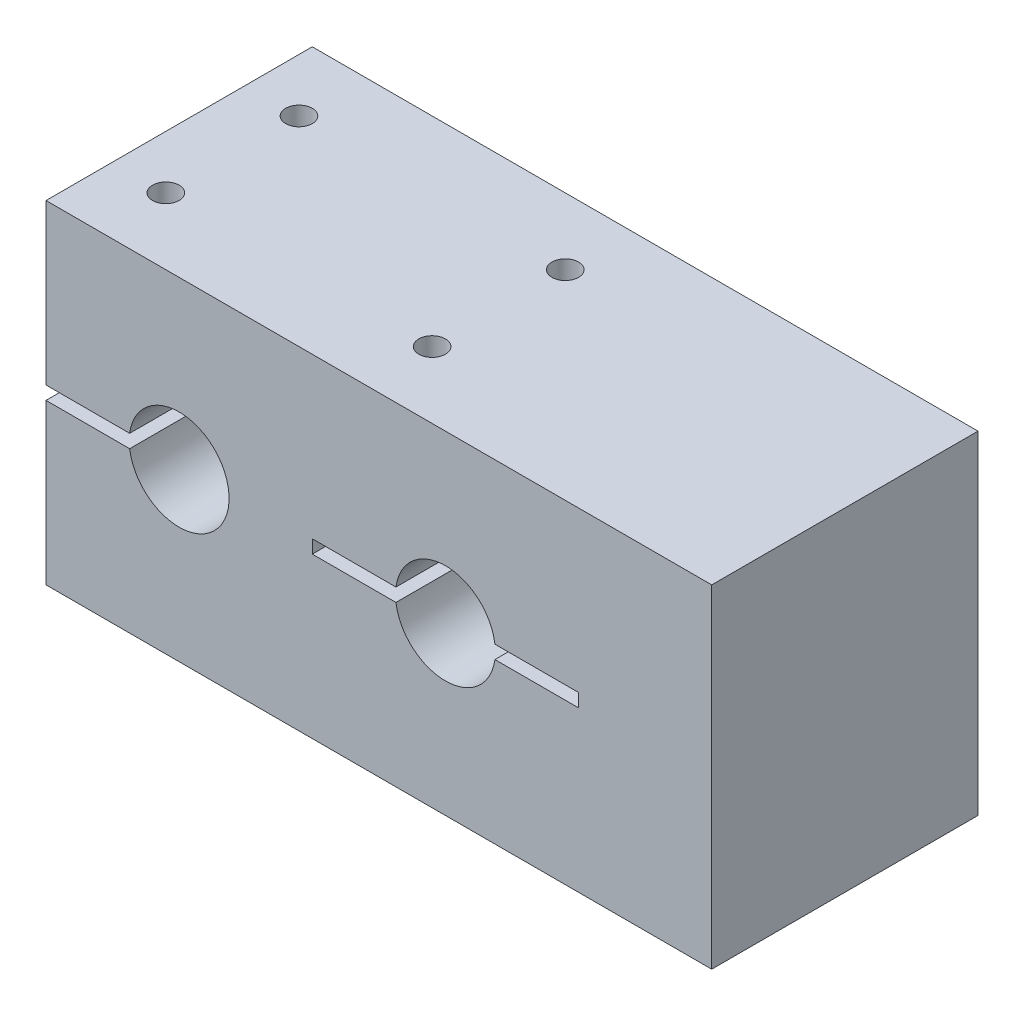
from build123d import *

# Parameters (mm, degrees)
EXTRUDE_1_DEPTH     = 40
SKETCH_8_R          = 2
CUT_EXTRUDE_5_DEPTH = 50


with BuildPart() as part:
    # Эскиз1 → Бобышка-Вытянуть1 (new body)
    with BuildSketch(Plane.XY):
        with BuildLine():
            Line((0, 0), (100, 0))
            Line((100, 0), (100, 34))
            Line((100, 34), (100, 50))
            Line((100, 50), (0, 50))
            Line((0, 50), (0, 26))
            Line((0, 26), (12.566965626, 26))
            ThreePointArc((12.566965626, 26), (27.5, 25), (12.566965626, 24))
            Line((12.566965626, 24), (0, 24))
            Line((0, 24), (0, 0))
        make_face()
        with BuildLine():
            Line((52.566965626, 26), (40, 26))
            Line((40, 26), (40, 24))
            Line((40, 24), (52.566965626, 24))
            ThreePointArc((52.566965626, 24), (60, 17.5), (67.433034374, 24))
            Line((67.433034374, 24), (80, 24))
            Line((80, 24), (80, 26))
            Line((80, 26), (67.433034374, 26))
            ThreePointArc((67.433034374, 26), (60, 32.5), (52.566965626, 26))
        make_face(mode=Mode.SUBTRACT)
    extrude(amount=EXTRUDE_1_DEPTH)

    # Эскиз8 → Вырез-Вытянуть5 (cut)
    with BuildSketch(Plane.XZ):
        with Locations(Location((8, 30, 0), (0, 0, 270))):
            Circle(SKETCH_8_R)
        with Locations(Location((8, 10, 0), (0, 0, 270))):
            Circle(SKETCH_8_R)
        with Locations(Location((48, 30, 0), (0, 0, 270))):
            Circle(SKETCH_8_R)
        with Locations(Location((48, 10, 0), (0, 0, 270))):
            Circle(SKETCH_8_R)
    extrude(amount=-CUT_EXTRUDE_5_DEPTH, mode=Mode.SUBTRACT)


solid = part.part
